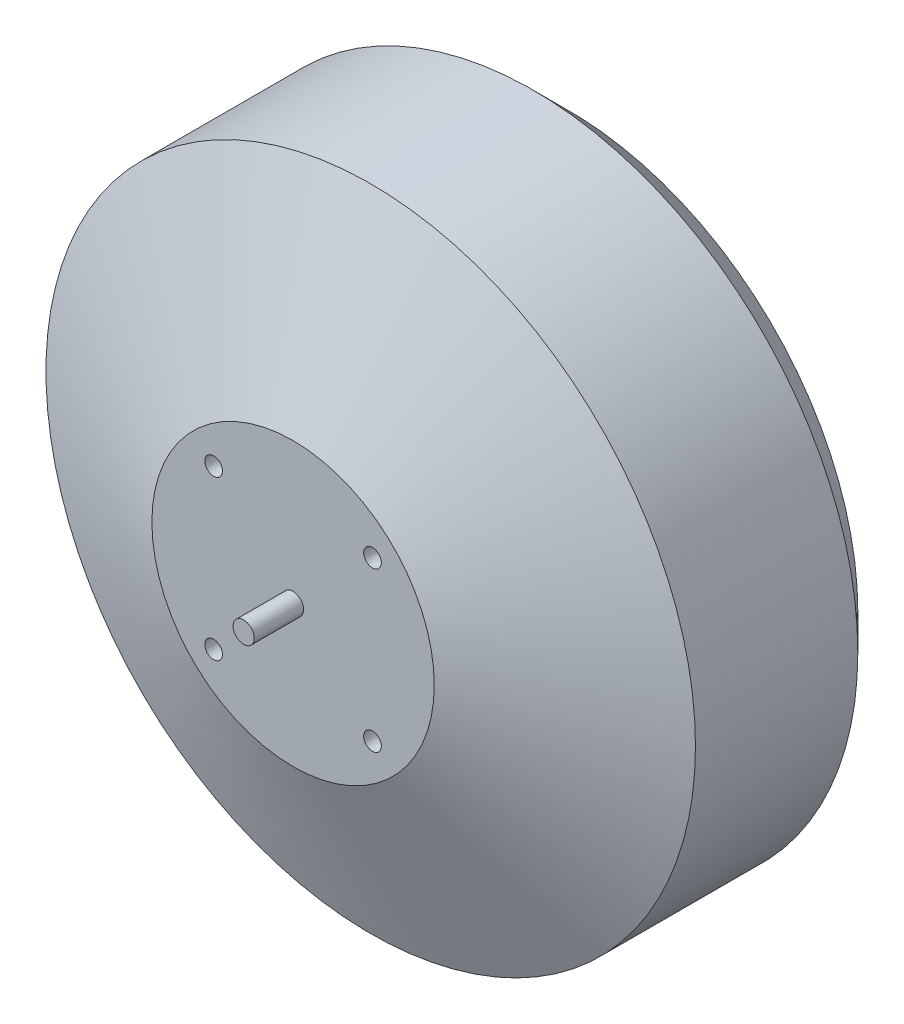
from build123d import *

# Parameters (mm, degrees)
SKETCH2_R          = 1.25
ROTOR_HOLES_DEPTH  = 10
SKETCH4_R          = 1.75
STATOR_HOLES_DEPTH = 10
SKETCH5_R          = 1.75
HOLE_DEPTH         = 5
FILLET1_R          = 1
SKETCH6_R          = 1.5
SHAFT_DEPTH        = 7
CHAMFER1_SIZE      = 5


with BuildPart() as part:
    # Sketch1 → Body (revolve)
    with BuildSketch(Plane(origin=(0, 0, 0), x_dir=(0, 0, -1), z_dir=(1, 0, 0)), mode=Mode.PRIVATE) as body_sk:
        Polygon((0, 46), (-28, 46), (-39, 20), (-39, 0), (0, 0), align=None)
    revolve(body_sk.sketch.rotate(Axis((0, 0, 1764.481038956), (0, 0, -1)), 90), axis=Axis((0, 0, 1764.481038956), (0, 0, -1)))

    # Sketch2 → Rotor_Holes (cut)
    with BuildSketch(Plane.XY.offset(39)):
        with Locations((-11.25, 11.25)):
            Circle(SKETCH2_R)
        with Locations((11.25, 11.25)):
            Circle(SKETCH2_R)
        with Locations((11.25, -11.25)):
            Circle(SKETCH2_R)
        with Locations((-11.25, -11.25)):
            Circle(SKETCH2_R)
    extrude(amount=-ROTOR_HOLES_DEPTH, mode=Mode.SUBTRACT)

    # Sketch4 → Stator_Holes (cut)
    with BuildSketch(Plane(origin=(0, 0, 0), x_dir=(-1, 0, 0), z_dir=(0, 0, -1))):
        with Locations((-14.25, 14.25)):
            Circle(SKETCH4_R)
        with Locations((14.25, 14.25)):
            Circle(SKETCH4_R)
        with Locations((14.25, -14.25)):
            Circle(SKETCH4_R)
        with Locations((-14.25, -14.25)):
            Circle(SKETCH4_R)
    extrude(amount=-STATOR_HOLES_DEPTH, mode=Mode.SUBTRACT)

    # Sketch5 → Hole (cut)
    with BuildSketch(Plane(origin=(0, 0, 0), x_dir=(-1, 0, 0), z_dir=(0, 0, -1))):
        Circle(SKETCH5_R)
    extrude(amount=-HOLE_DEPTH, mode=Mode.SUBTRACT)

    # Fillet1
    fillet1_edges = [part.edges().sort_by_distance(p)[0] for p in [
        (1.75, 0, 0),
    ]]
    fillet(fillet1_edges, radius=FILLET1_R)

    # Sketch6 → Shaft (add)
    with BuildSketch(Plane.XY.offset(39)):
        with Locations(Location((0, 0, 0), (0, 0, 180))):
            Circle(SKETCH6_R)
    extrude(amount=SHAFT_DEPTH)

    # Chamfer1
    chamfer1_edges = [part.edges().sort_by_distance(p)[0] for p in [
        (-46, 0, 0),
    ]]
    chamfer(chamfer1_edges, length=CHAMFER1_SIZE)


solid = part.part
